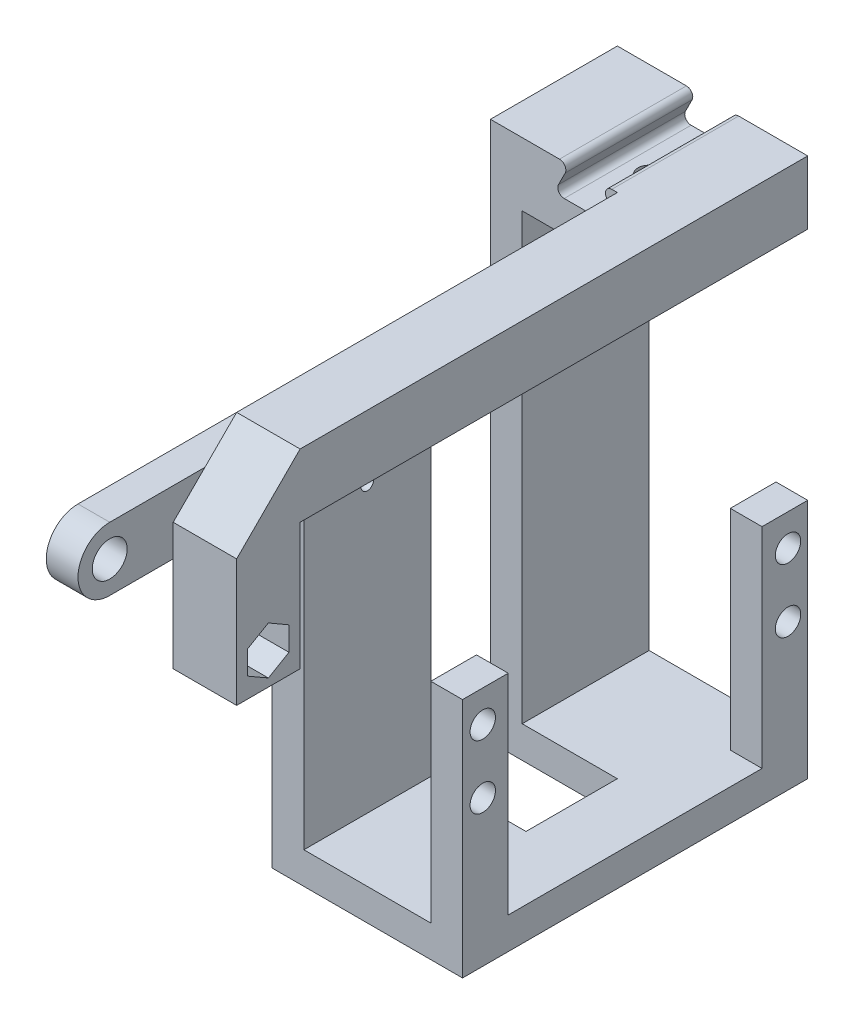
from build123d import *

# Parameters (mm, degrees)
ESBO_O1_W                = 5
ESBO_O1_H                = 33
RESSALTO_EXTRUS_O1_DEPTH = 80
ESBO_O2_W                = 40
ESBO_O2_H                = 33
ESBO_O2_W_2              = 25.6
CORTE_EXTRUS_O1_DEPTH    = 19
ESBO_O4_R                = 2
CORTE_EXTRUS_O3_DEPTH    = 12
ESBO_O5_W                = 10
ESBO_O5_H                = 20
RESSALTO_EXTRUS_O2_DEPTH = 10
ESBO_O6_R                = 1.75
CORTE_EXTRUS_O4_DEPTH    = 15
CORTE_EXTRUS_O5_DEPTH    = 5
ESBO_O8_R                = 5
ESBO_O8_R_2              = 2.75
RESSALTO_EXTRUS_O3_DEPTH = 5
ESBO_O9_W                = 20
ESBO_O9_H                = 20
ESBO_O9_W_2              = 25
ESBO_O9_H_2              = 10
CORTE_EXTRUS_O6_DEPTH    = 25.6
CORTE_EXTRUS_O7_START    = -20
ESBO_O11_W               = 34.4
ESBO_O11_H               = 20
ESBO_O11_W_2             = 14.4
ESBO_O11_H_2             = 60
CORTE_EXTRUS_O7_DEPTH    = 20
ESBO_O12_R               = 1.75
CORTE_EXTRUS_O8_DEPTH    = 25
CORTE_EXTRUS_O9_DEPTH    = 2.5
FILETE1_R                = 1
FILETE2_R                = 1
ESBO_O15_W               = 30
ESBO_O15_H               = 5
CORTE_EXTRUS_O11_DEPTH   = 120
ESBO_O16_R               = 1
CORTE_EXTRUS_O12_DEPTH   = 2


with BuildPart() as part:
    # Esboço1 → Ressalto-extrusão1 (new body)
    with BuildSketch(Plane.XY):
        Polygon((-2.5, 45), (-15, 45), (-15, 35), (-10, 35), (15, 35), (15, 45), (2.5, 45), (5, 40), (-5, 40), align=None)
        Polygon((-10, 35), (-15, 35), (-15, -45), (-10, -45), (-10, -35), align=None)
        Polygon((-10, -35), (-10, -45), (15, -45), (15, -35), (10, -35), align=None)
        with Locations((12.5, -18.5)):
            Rectangle(ESBO_O1_W, ESBO_O1_H)
    extrude(amount=RESSALTO_EXTRUS_O1_DEPTH)

    # Esboço2 → Corte-extrusão1 (cut)
    with BuildSketch(Plane(origin=(15, 0, 0), x_dir=(0, 0, -1), z_dir=(1, 0, 0))):
        with Locations((-27.2, -18.5)):
            Rectangle(ESBO_O2_W, ESBO_O2_H)
        with Locations((-67.2, -18.5)):
            Rectangle(ESBO_O2_W_2, ESBO_O2_H)
    extrude(amount=-CORTE_EXTRUS_O1_DEPTH, mode=Mode.SUBTRACT)

    # Esboço4 → Corte-extrusão3 (cut)
    with BuildSketch(Plane.ZY.offset(-10)):
        with Locations(Location((3.104223841, -7.000828192, 0), (0, 0, 270))):
            Circle(ESBO_O4_R)
        with Locations(Location((3.104223841, -17.002484575, 0), (0, 0, 270))):
            Circle(ESBO_O4_R)
        with Locations(Location((51.210481376, -17.002484575, 0), (0, 0, 270))):
            Circle(ESBO_O4_R)
        with Locations(Location((51.210481376, -7.000828192, 0), (0, 0, 270))):
            Circle(ESBO_O4_R)
    extrude(amount=-CORTE_EXTRUS_O3_DEPTH, mode=Mode.SUBTRACT)

    # Esboço5 → Ressalto-extrusão2 (add)
    with BuildSketch(Plane(origin=(15, 0, 0), x_dir=(0, 0, -1), z_dir=(1, 0, 0))):
        with Locations((-85, 25)):
            Rectangle(ESBO_O5_W, ESBO_O5_H)
        Polygon((-90, 35), (-80, 45), (-80, 35), align=None)
    extrude(amount=-RESSALTO_EXTRUS_O2_DEPTH)

    # Esboço6 → Corte-extrusão4 (cut)
    with BuildSketch(Plane(origin=(15, 0, 0), x_dir=(0, 0, -1), z_dir=(1, 0, 0))):
        with Locations(Location((-85, 20, 0), (0, 0, 90))):
            Circle(ESBO_O6_R)
    extrude(amount=-CORTE_EXTRUS_O4_DEPTH, mode=Mode.SUBTRACT)

    # Esboço7 → Corte-extrusão5 (cut)
    with BuildSketch(Plane(origin=(15, 0, 0), x_dir=(0, 0, -1), z_dir=(1, 0, 0))):
        Polygon((-81.75, 21.876388375), (-85, 23.75277675), (-88.25, 21.876388375), (-88.25, 18.123611625), (-85, 16.24722325), (-81.75, 18.123611625), align=None)
    extrude(amount=-CORTE_EXTRUS_O5_DEPTH, mode=Mode.SUBTRACT)

    # Esboço8 → Ressalto-extrusão3 (add)
    # profile 1 of 3: a face of its own
    with BuildSketch(Plane.ZY.offset(15)):
        with BuildLine():
            Line((80, 25), (80, 20.00000004))
            ThreePointArc((80, 20.00000004), (81.464466108, 23.53553392), (85, 25))
            Line((85, 25), (80, 25))
        make_face()
    # profile 2 of 3: a face of its own
    with BuildSketch(Plane.ZY.offset(15)):
        with Locations((85, 20)):
            Circle(ESBO_O8_R)
        with Locations(Location((85, 20, 0), (0, 0, 270))):
            Circle(ESBO_O8_R_2, mode=Mode.SUBTRACT)
    # profile 3 of 3: a face of its own
    with BuildSketch(Plane.ZY.offset(15)):
        with BuildLine():
            Line((80, 15), (85, 15))
            ThreePointArc((85, 15), (81.46446608, 16.464466108), (80, 20.00000004))
            Line((80, 20.00000004), (80, 15))
        make_face()
    extrude(amount=-RESSALTO_EXTRUS_O3_DEPTH)

    # Esboço9 → Corte-extrusão6 (cut)
    with BuildSketch(Plane.XY.offset(80)):
        with Locations((-5, 35)):
            Rectangle(ESBO_O9_W, ESBO_O9_H)
        Polygon((-15, 15), (-15, -45), (-10, -45), (-10, -35), (-10, 15), align=None)
        with Locations((2.5, -40)):
            Rectangle(ESBO_O9_W_2, ESBO_O9_H_2)
    extrude(amount=-CORTE_EXTRUS_O6_DEPTH, mode=Mode.SUBTRACT)

    # Esboço11 → Corte-extrusão7 (cut)
    with BuildSketch(Plane.ZY.offset(15).offset(CORTE_EXTRUS_O7_START)):
        with Locations((37.2, 35)):
            Rectangle(ESBO_O11_W, ESBO_O11_H)
        with Locations((27.2, -15)):
            Rectangle(ESBO_O11_W_2, ESBO_O11_H_2)
    extrude(amount=CORTE_EXTRUS_O7_DEPTH, mode=Mode.SUBTRACT)

    # Esboço12 → Corte-extrusão8 (cut)
    with BuildSketch(Plane(origin=(0, 40, 0), x_dir=(1, 0, 0), z_dir=(0, 1, 0))):
        with Locations(Location((0, -10, 0), (0, 0, 270))):
            Circle(ESBO_O12_R)
    extrude(amount=-CORTE_EXTRUS_O8_DEPTH, mode=Mode.SUBTRACT)

    # Esboço13 → Corte-extrusão9 (cut)
    with BuildSketch(Plane.XZ.offset(-35)):
        Polygon((0, 6.24722325), (3.25, 8.123611625), (3.25, 11.876388375), (0, 13.75277675), (-3.25, 11.876388375), (-3.25, 8.123611625), align=None)
    extrude(amount=-CORTE_EXTRUS_O9_DEPTH, mode=Mode.SUBTRACT)

    # Filete1
    filete1_edges = [part.edges().sort_by_distance(p)[0] for p in [
        (2.5, 45, 10),
        (-2.5, 45, 10),
    ]]
    fillet(filete1_edges, radius=FILETE1_R)

    # Filete2
    filete2_edges = [part.edges().sort_by_distance(p)[0] for p in [
        (-5, 40, 10),
        (5, 40, 10),
    ]]
    fillet(filete2_edges, radius=FILETE2_R)

    # Esboço15 → Corte-extrusão11 (cut)
    with BuildSketch(Plane.XY.offset(54.4)):
        with Locations((0, -42.5)):
            Rectangle(ESBO_O15_W, ESBO_O15_H)
    extrude(amount=-CORTE_EXTRUS_O11_DEPTH, mode=Mode.SUBTRACT)

    # Esboço16 → Corte-extrusão12 (cut)
    with BuildSketch(Plane(origin=(-10, 0, 0), x_dir=(0, 0, -1), z_dir=(1, 0, 0))):
        with Locations(Location((-29.4, 20, 0), (0, 0, 90))):
            Circle(ESBO_O16_R)
        with Locations(Location((-44.4, 10, 0), (0, 0, 90))):
            Circle(ESBO_O16_R)
    extrude(amount=-CORTE_EXTRUS_O12_DEPTH, mode=Mode.SUBTRACT)


solid = part.part
